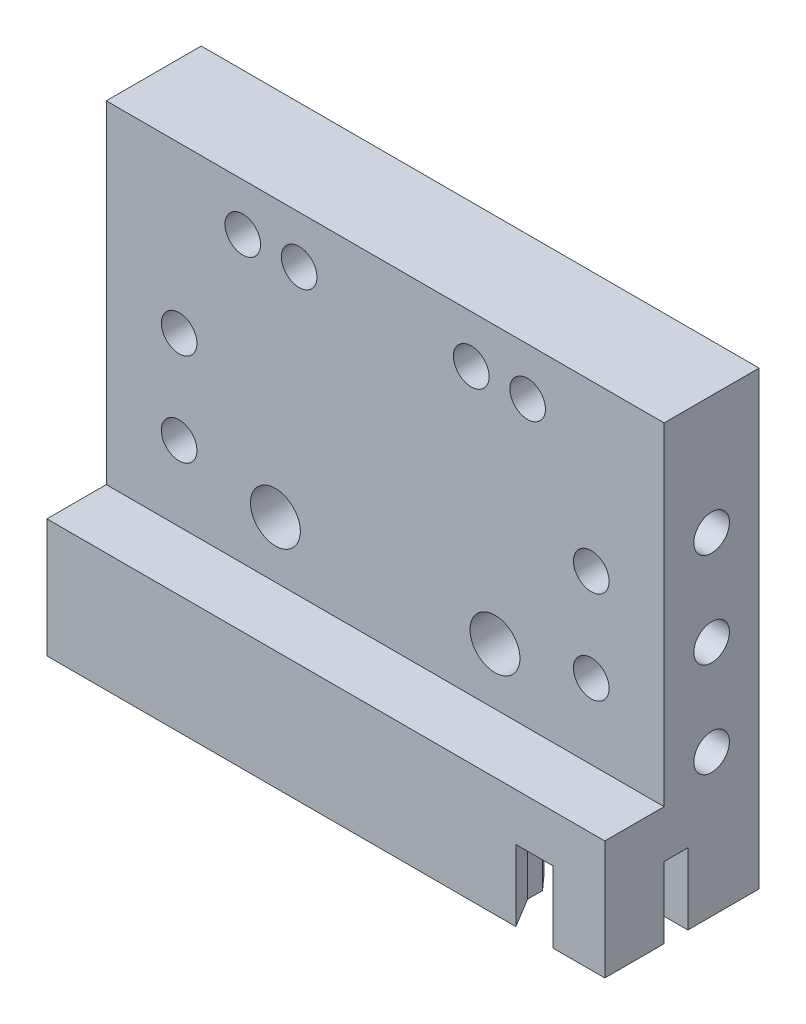
from build123d import *

# Parameters (mm, degrees)
SKETCH_1_W          = 47
SKETCH_1_H          = 38
SKETCH_1_R          = 1.5
SKETCH_1_R_2        = 2.1
EXTRUDE_1_DEPTH     = 8
SKETCH_2_R          = 3.75
SKETCH_2_W          = 30
SKETCH_2_H          = 10
CUT_EXTRUDE_1_DEPTH = 4.5
SKETCH_3_W          = 47
SKETCH_3_H          = 10
EXTRUDE_2_DEPTH     = 5
CUT_EXTRUDE_2_DEPTH = 6
SKETCH_5_R          = 1.5
CUT_EXTRUDE_3_DEPTH = 6
SKETCH_6_R          = 1.5
CUT_EXTRUDE_4_DEPTH = 6
CUT_EXTRUDE_START   = -6
SKETCH_7_R          = 1.5
CUT_EXTRUDE_5_DEPTH = 6
SKETCH_8_R          = 1.5
CUT_EXTRUDE_6_DEPTH = 62.822326064


with BuildPart() as part:
    # 草图1 → 凸台-拉伸1 (new body)
    with BuildSketch(Plane.XY):
        with Locations((23.5, 19)):
            Rectangle(SKETCH_1_W, SKETCH_1_H)
        with Locations((16.25, 34)):
            Circle(SKETCH_1_R, mode=Mode.SUBTRACT)
        with Locations((30.75, 34)):
            Circle(SKETCH_1_R, mode=Mode.SUBTRACT)
        with Locations((32.75, 14.75)):
            Circle(SKETCH_1_R_2, mode=Mode.SUBTRACT)
        with Locations((14.25, 14.75)):
            Circle(SKETCH_1_R_2, mode=Mode.SUBTRACT)
        with Locations((11.5, 34)):
            Circle(SKETCH_1_R, mode=Mode.SUBTRACT)
        with Locations((35.5, 34)):
            Circle(SKETCH_1_R, mode=Mode.SUBTRACT)
    extrude(amount=EXTRUDE_1_DEPTH)

    # 草图2 → 切除-拉伸1 (cut)
    with BuildSketch(Plane(origin=(0, 0, 0), x_dir=(-1, 0, 0), z_dir=(0, 0, -1))):
        with Locations((-32.75, 14.75)):
            Circle(SKETCH_2_R)
        with Locations((-14.25, 14.75)):
            Circle(SKETCH_2_R)
        with Locations((-23.5, 5)):
            Rectangle(SKETCH_2_W, SKETCH_2_H)
    extrude(amount=-CUT_EXTRUDE_1_DEPTH, mode=Mode.SUBTRACT)

    # 草图3 → 凸台-拉伸2 (add)
    with BuildSketch(Plane.XY.offset(8)):
        with Locations((23.5, 5)):
            Rectangle(SKETCH_3_W, SKETCH_3_H)
    extrude(amount=EXTRUDE_2_DEPTH)

    # 草图4 → 切除-拉伸2 (cut)
    with BuildSketch(Plane.XZ):
        Polygon((0.499880505, 7), (0, 8), (0, 6), (47, 6), (47, 7.999217306), (44.9861953, 7.999292351), (44, 8.985487652), (44, 10.499664551), (42.641699926, 13), (39.504118259, 13), (38, 10.499670662), (38, 9.249505993), (36.882697476, 7.999594333), (25.996893132, 8), (25.496893132, 8), (24.997012627, 7), (24.497012627, 7), (23.997132122, 8), (23.497132122, 8), (22.997251617, 7), (22.497251617, 7), (21.997371111, 8), (21.497371111, 8), (20.997490606, 7), (20.497490606, 7), (19.997610101, 8), (19.497610101, 8), (18.997729596, 7), (18.497729596, 7), (17.997849091, 8), (17.497849091, 8), (16.997968586, 7), (16.497968586, 7), (15.998088081, 8), (15.498088081, 8), (14.998207576, 7), (14.498207576, 7), (13.998327071, 8), (13.498327071, 8), (12.998446566, 7), (12.498446566, 7), (11.998566061, 8), (11.498566061, 8), (10.998685556, 7), (10.498685556, 7), (9.998805051, 8), (9.498805051, 8), (8.998924546, 7), (8.498924546, 7), (7.999044041, 8), (7.499044041, 8), (6.999163535, 7), (6.499163535, 7), (5.99928303, 8), (5.49928303, 8), (4.999402525, 7), (4.499402525, 7), (3.99952202, 8), (3.49952202, 8), (2.999641515, 7), (2.499641515, 7), (1.99976101, 8), (1.49976101, 8), (0.999880505, 7), align=None)
    extrude(amount=-CUT_EXTRUDE_2_DEPTH, mode=Mode.SUBTRACT)

    # 草图5 → 切除-拉伸3 (cut)
    with BuildSketch(Plane(origin=(0, 0, 0), x_dir=(-1, 0, 0), z_dir=(0, 0, -1))):
        with Locations((-41.288047011, 3.201203266)):
            Circle(SKETCH_5_R)
    extrude(amount=-CUT_EXTRUDE_3_DEPTH, mode=Mode.SUBTRACT)

    # 草图6 → 切除-拉伸4 (cut)
    with BuildSketch(Plane(origin=(47, 0, 0), x_dir=(0, 0, -1), z_dir=(1, 0, 0))):
        with Locations((-4, 12)):
            Circle(SKETCH_6_R)
        with Locations((-4, 20)):
            Circle(SKETCH_6_R)
        with Locations((-4, 28)):
            Circle(SKETCH_6_R)
    extrude(amount=-CUT_EXTRUDE_4_DEPTH, mode=Mode.SUBTRACT)

    # 草图7 → 切除-拉伸5 (cut)
    with BuildSketch(Plane.ZY.offset(CUT_EXTRUDE_START)):
        with Locations((4, 12)):
            Circle(SKETCH_7_R)
        with Locations((4, 20)):
            Circle(SKETCH_7_R)
        with Locations((4, 28)):
            Circle(SKETCH_7_R)
    extrude(amount=CUT_EXTRUDE_5_DEPTH, mode=Mode.SUBTRACT)

    # 草图8 → 切除-拉伸6 (cut, through all)
    with BuildSketch(Plane(origin=(0, 0, 0), x_dir=(-1, 0, 0), z_dir=(0, 0, -1))):
        with Locations((-40.861215873, 16.298578495)):
            Circle(SKETCH_8_R)
        with Locations((-40.861215873, 24.11472755)):
            Circle(SKETCH_8_R)
        with Locations((-6.138784127, 16.298578495)):
            Circle(SKETCH_8_R)
        with Locations((-6.138784127, 24.11472755)):
            Circle(SKETCH_8_R)
    extrude(amount=-CUT_EXTRUDE_6_DEPTH, mode=Mode.SUBTRACT)


solid = part.part
